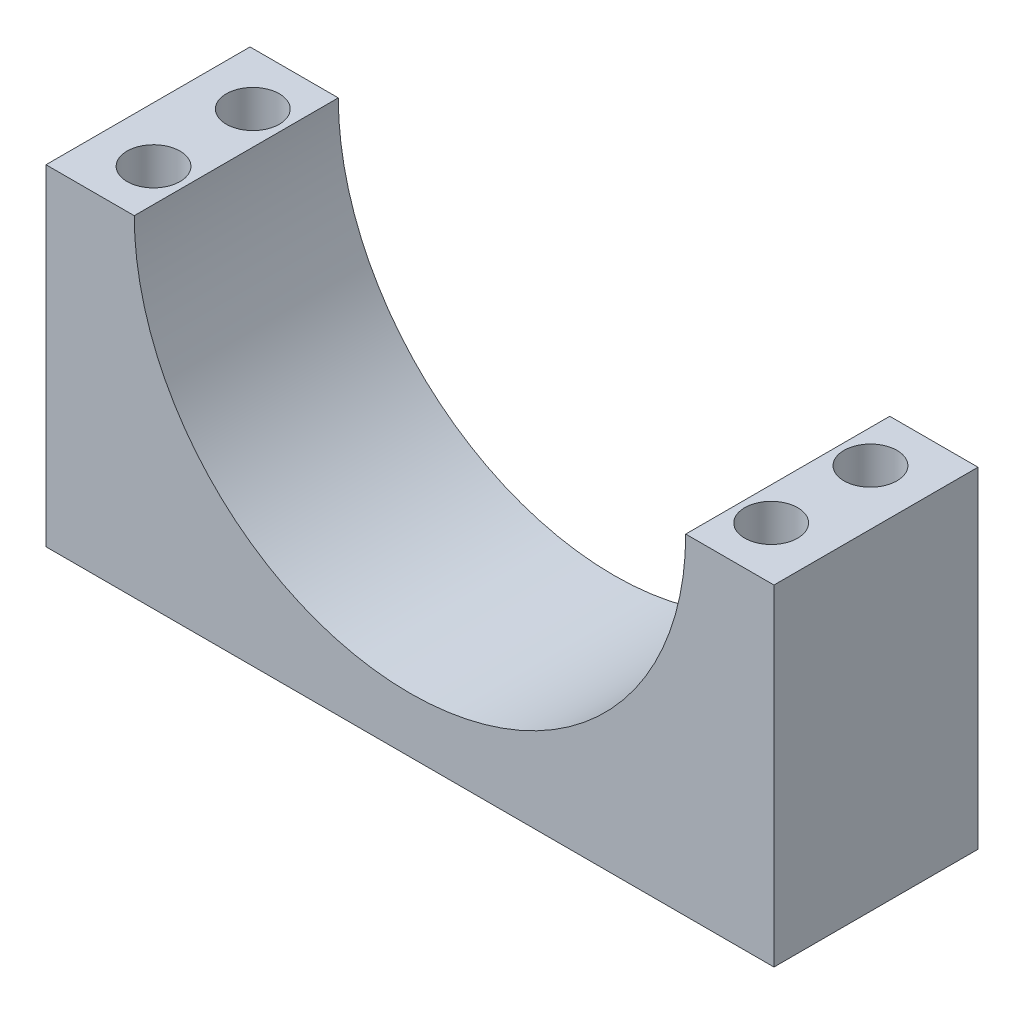
from build123d import *

# Parameters (mm, degrees)
SKETCH_1_W                   = 66
SKETCH_1_H                   = 30
EXTRUDE_1_DEPTH              = 18.5
SKETCH_2_R                   = 25
CUT_EXTRUDE_1_DEPTH          = 75.821454143
HOLE_WIZARD_M4_1_D           = 4.8
HOLE_WIZARD_M4_1_CBORE_D     = 8
HOLE_WIZARD_M4_1_CBORE_DEPTH = 4


with BuildPart() as part:
    # 草图1 → 凸台-拉伸1 (new body)
    with BuildSketch(Plane.XY):
        with Locations((33, 15)):
            Rectangle(SKETCH_1_W, SKETCH_1_H)
    extrude(amount=EXTRUDE_1_DEPTH)

    # 草图2 → 切除-拉伸1 (cut, through all)
    with BuildSketch(Plane.XY.offset(18.5)):
        with Locations((33, 30)):
            Circle(SKETCH_2_R)
    extrude(amount=-CUT_EXTRUDE_1_DEPTH, mode=Mode.SUBTRACT)

    # M4 六角凹头螺钉的柱形沉头孔1 (through all)
    with Locations(Plane.XZ):
        with Locations((5, 13.75), (5, 4.75), (61, 13.75), (61, 4.75)):
            CounterBoreHole(HOLE_WIZARD_M4_1_D / 2, HOLE_WIZARD_M4_1_CBORE_D / 2, HOLE_WIZARD_M4_1_CBORE_DEPTH)


solid = part.part
